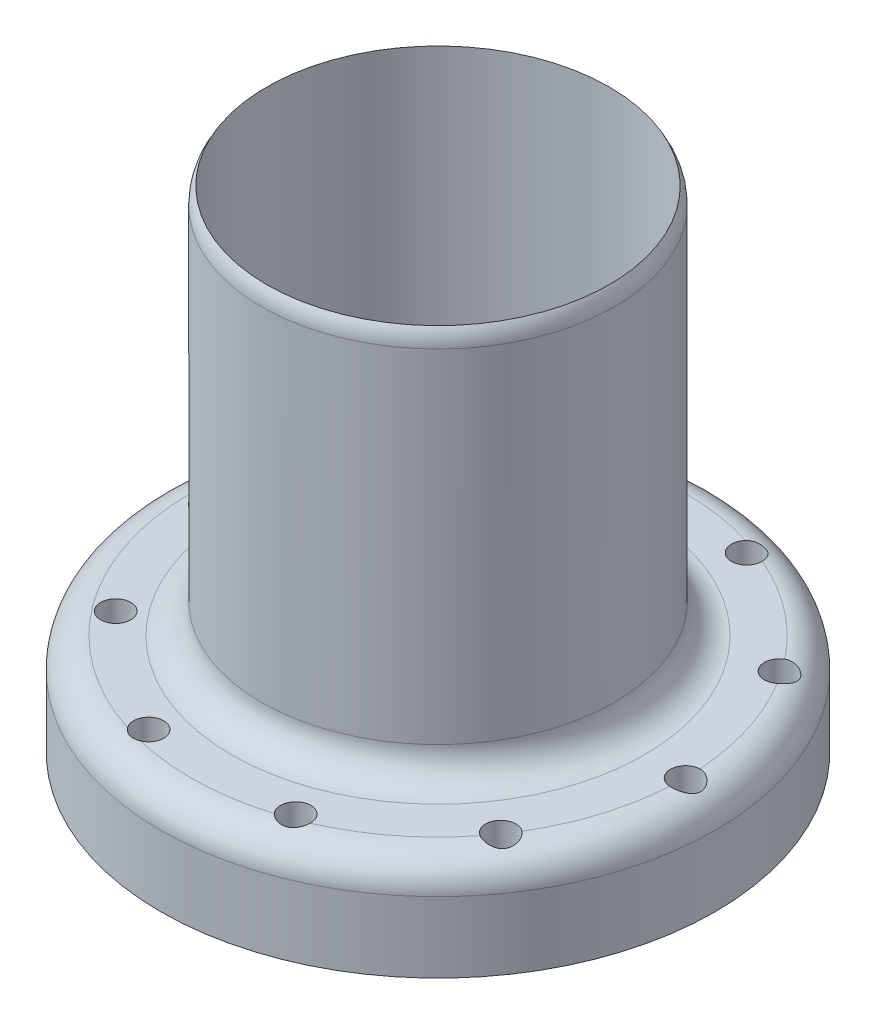
from build123d import *

# Parameters (mm, degrees)
SKETCH1_R           = 17.5
BOSS_EXTRUDE1_DEPTH = 50
BOSS_EXTRUDE2_START = -50
SKETCH2_R           = 27.5
BOSS_EXTRUDE2_DEPTH = 10
FILLET1_R           = 3
SKETCH3_R           = 17
CUT_EXTRUDE1_DEPTH  = 50
SKETCH5_R           = 1.5
CUT_EXTRUDE4_DEPTH  = 10


with BuildPart() as part:
    # Sketch1 → Boss-Extrude1 (new body)
    with BuildSketch(Plane(origin=(0, 0, 0), x_dir=(1, 0, 0), z_dir=(0, 1, 0))):
        with Locations(Location((0, 0, 0), (0, 0, 90))):
            Circle(SKETCH1_R)
    extrude(amount=BOSS_EXTRUDE1_DEPTH)

    # Sketch2 → Boss-Extrude2 (add)
    with BuildSketch(Plane(origin=(0, 50, 0), x_dir=(1, 0, 0), z_dir=(0, 1, 0)).offset(BOSS_EXTRUDE2_START)):
        with Locations(Location((0, 0, 0), (0, 0, 270))):
            Circle(SKETCH2_R)
    extrude(amount=BOSS_EXTRUDE2_DEPTH)

    # Fillet1
    fillet1_edges = [part.edges().sort_by_distance(p)[0] for p in [
        (0, 50, 17.5),
        (0, 10, 17.5),
        (0, 10, -27.5),
    ]]
    fillet(fillet1_edges, radius=FILLET1_R)

    # Sketch3 → Cut-Extrude1 (cut)
    with BuildSketch(Plane(origin=(0, 50, 0), x_dir=(1, 0, 0), z_dir=(0, 1, 0))):
        with Locations(Location((0, 0, 0), (0, 0, 270))):
            Circle(SKETCH3_R)
    extrude(amount=-CUT_EXTRUDE1_DEPTH, mode=Mode.SUBTRACT)

    # Sketch5 → Cut-Extrude4 (cut)
    with BuildSketch(Plane(origin=(0, 10, 0), x_dir=(1, 0, 0), z_dir=(0, 1, 0))):
        with Locations(Location((-22.617014995, -0.042550907, 0), (0, 0, 270))):
            Circle(SKETCH5_R)
        with Locations(Location((-18.139935623, 13.821584384, 0), (0, 0, 270))):
            Circle(SKETCH5_R)
        with Locations(Location((-6.368768067, 22.406344218, 0), (0, 0, 270))):
            Circle(SKETCH5_R)
        with Locations(Location((8.200301755, 22.432642125, 0), (0, 0, 270))):
            Circle(SKETCH5_R)
        with Locations(Location((20.002384355, 13.890433198, 0), (0, 0, 270))):
            Circle(SKETCH5_R)
        with Locations(Location((24.529485319, 0.042550907, 0), (0, 0, 270))):
            Circle(SKETCH5_R)
        with Locations(Location((20.052405947, -13.821584384, 0), (0, 0, 270))):
            Circle(SKETCH5_R)
        with Locations(Location((8.28123839, -22.406344218, 0), (0, 0, 270))):
            Circle(SKETCH5_R)
        with Locations(Location((-6.287831432, -22.432642125, 0), (0, 0, 270))):
            Circle(SKETCH5_R)
        with Locations(Location((-18.089914032, -13.890433198, 0), (0, 0, 270))):
            Circle(SKETCH5_R)
    extrude(amount=-CUT_EXTRUDE4_DEPTH, mode=Mode.SUBTRACT)


solid = part.part
